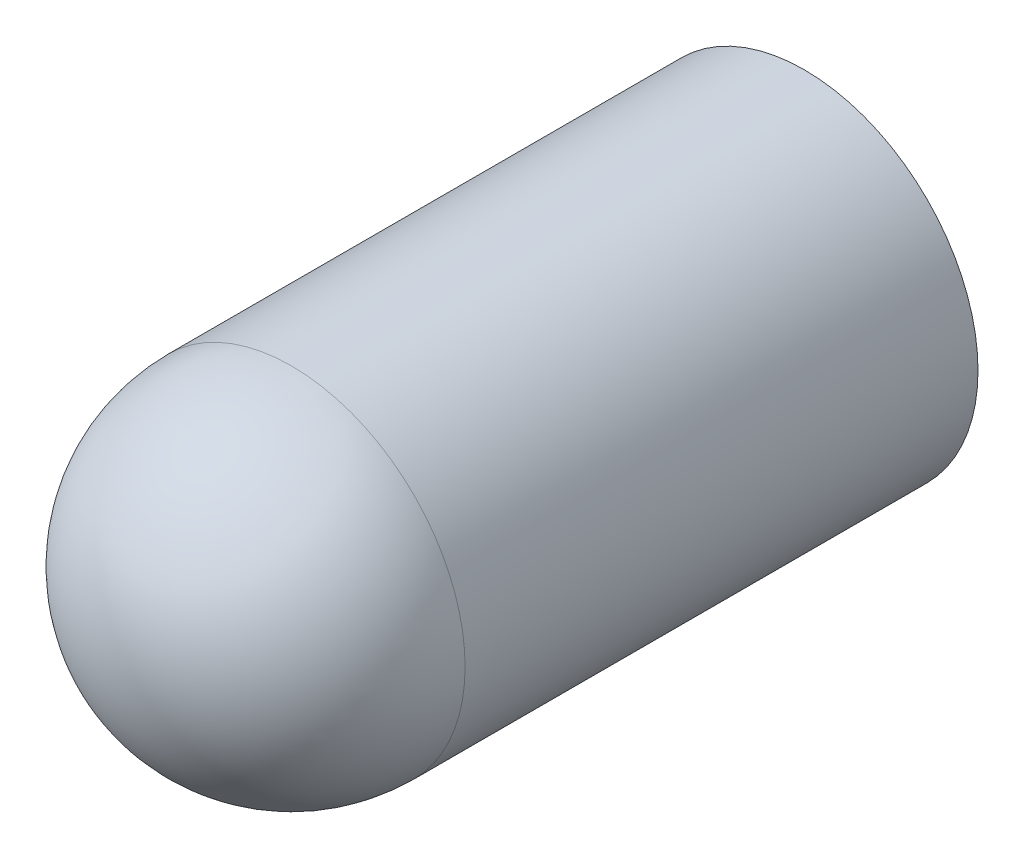
from build123d import *


with BuildPart() as part:
    # Sketch1 → Revolve2 (revolve)
    with BuildSketch(Plane(origin=(0, 0, 0), x_dir=(1, 0, 0), z_dir=(0, 1, 0)), mode=Mode.PRIVATE) as revolve2_sk:
        with BuildLine():
            Line((1.27, 0), (1.27, -8.255))
            ThreePointArc((1.27, -8.255), (0.898025612, -9.153025612), (0, -9.525))
            Line((0, -9.525), (0, -11.049))
            ThreePointArc((0, -11.049), (1.975656347, -10.230656347), (2.794, -8.255))
            Line((2.794, -8.255), (2.794, 0))
            Line((2.794, 0), (1.27, 0))
        make_face()
    revolve(revolve2_sk.sketch.rotate(Axis((0, 0, 0), (0, 0, 1)), 180), axis=Axis((0, 0, 0), (0, 0, 1)))


solid = part.part
